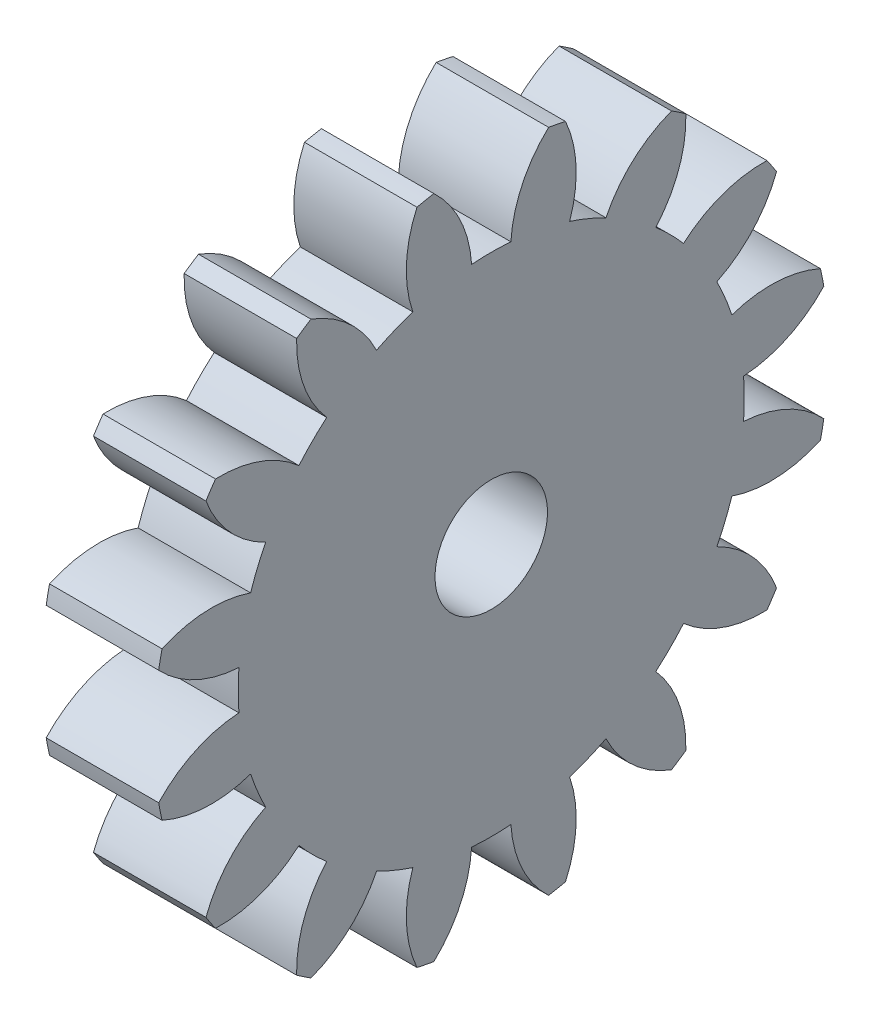
from build123d import *

# Parameters (mm, degrees)
BASPROSKE_W     = 3
BASPROSKE_H     = 9
TOOTHCUT_DEPTH  = 14.076696831
TEETHCUTS_COUNT = 16
TEETHCUTS_ANGLE = 337.5
BORSKE_R        = 1.5
BORE_DEPTH      = 15.0000508


with BuildPart() as part:
    # BasProSke → Base-Revolve (revolve)
    with BuildSketch(Plane(origin=(0, 0, 0), x_dir=(1, 0, 0), z_dir=(0, 1, 0)), mode=Mode.PRIVATE) as base_revolve_sk:
        with Locations((1.5, 4.5)):
            Rectangle(BASPROSKE_W, BASPROSKE_H)
    revolve(base_revolve_sk.sketch.rotate(Axis((-10, 0, 0), (1, 0, 0)), 180), axis=Axis((-10, 0, 0), (1, 0, 0)))

    # TooCutSke → ToothCut (cut, through all)
    with BuildSketch(Plane(origin=(0, 0, 0), x_dir=(0, 0, -1), z_dir=(1, 0, 0))):
        with BuildLine():
            ThreePointArc((0.523792937, 6.728643397), (0, 6.749), (-0.523792937, 6.728643397))
            ThreePointArc((-0.523792937, 6.728643397), (-0.828704482, 7.90962059), (-1.553355277, 8.890721711))
            ThreePointArc((-1.553355277, 8.890721711), (0, 9.0254), (1.553355277, 8.890721711))
            ThreePointArc((1.553355277, 8.890721711), (0.828704482, 7.90962059), (0.523792937, 6.728643397))
        make_face()
    toothcut = extrude(amount=TOOTHCUT_DEPTH, mode=Mode.SUBTRACT)

    # TeethCuts: ToothCut ×16 about axis
    teethcuts_axis = Axis((-10, 0, 0), (1, 0, 0))
    for i in range(1, TEETHCUTS_COUNT):
        add(toothcut.rotate(teethcuts_axis, i * TEETHCUTS_ANGLE / (TEETHCUTS_COUNT - 1)), mode=Mode.SUBTRACT)

    # BorSke → Bore (cut, symmetric)
    with BuildSketch(Plane(origin=(0, 0, 0), x_dir=(0, 0, -1), z_dir=(1, 0, 0))):
        with Locations(Location((0, 0, 0), (0, 0, 180))):
            Circle(BORSKE_R)
    extrude(amount=BORE_DEPTH, both=True, mode=Mode.SUBTRACT)


solid = part.part
